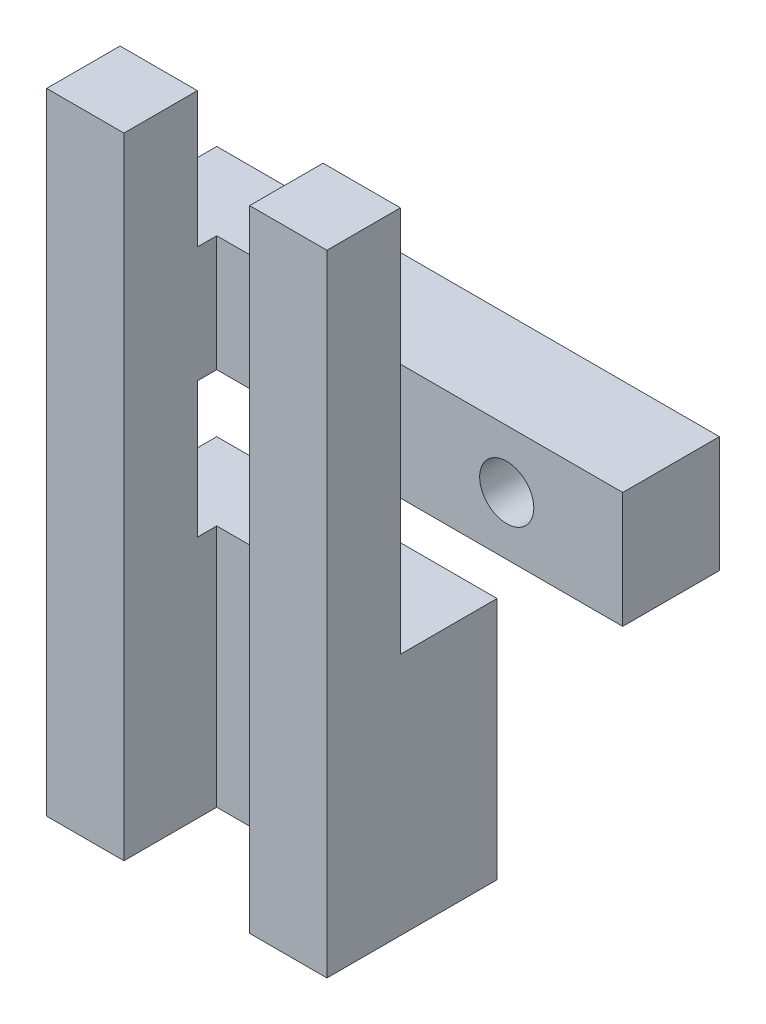
from build123d import *

# Parameters (mm, degrees)
SKETCH_1_W          = 26
SKETCH_1_H          = 6
SKETCH_1_R          = 1.4
EXTRUDE_1_DEPTH     = 5
SKETCH_2_W          = 4
SKETCH_2_H          = 32.6
EXTRUDE_2_DEPTH     = 3.8
SKETCH_3_W          = 6.5
SKETCH_3_H          = 6
CUT_EXTRUDE_1_DEPTH = 1
SKETCH_4_W          = 14.5
SKETCH_4_H          = 12.6
EXTRUDE_3_DEPTH     = 5
SKETCH_5_W          = 6.5
SKETCH_5_H          = 12.6
CUT_EXTRUDE_2_DEPTH = 1


with BuildPart() as part:
    # 草图1 → 凸台-拉伸1 (new body)
    with BuildSketch(Plane.XY):
        with Locations((13, -3)):
            Rectangle(SKETCH_1_W, SKETCH_1_H)
        with Locations((20, -3)):
            Circle(SKETCH_1_R, mode=Mode.SUBTRACT)
    extrude(amount=EXTRUDE_1_DEPTH)

    # 草图2 → 凸台-拉伸2 (add)
    with BuildSketch(Plane.XY.offset(5)):
        with Locations((2, -9.3)):
            Rectangle(SKETCH_2_W, SKETCH_2_H)
        with Locations((12.5, -9.3)):
            Rectangle(SKETCH_2_W, SKETCH_2_H)
    extrude(amount=EXTRUDE_2_DEPTH)

    # 草图3 → 切除-拉伸1 (cut)
    with BuildSketch(Plane.XY.offset(5)):
        with Locations((7.25, -3)):
            Rectangle(SKETCH_3_W, SKETCH_3_H)
    extrude(amount=-CUT_EXTRUDE_1_DEPTH, mode=Mode.SUBTRACT)

    # 草图4 → 凸台-拉伸3 (add)
    with BuildSketch(Plane(origin=(0, 0, 5), x_dir=(-1, 0, 0), z_dir=(0, 0, -1))):
        with Locations((-7.25, -19.3)):
            Rectangle(SKETCH_4_W, SKETCH_4_H)
    extrude(amount=EXTRUDE_3_DEPTH)

    # 草图5 → 切除-拉伸2 (cut)
    with BuildSketch(Plane.XY.offset(5)):
        with Locations((7.25, -19.3)):
            Rectangle(SKETCH_5_W, SKETCH_5_H)
    extrude(amount=-CUT_EXTRUDE_2_DEPTH, mode=Mode.SUBTRACT)


solid = part.part
